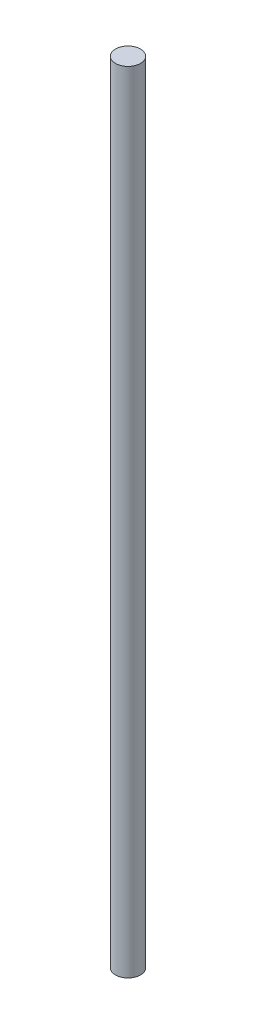
from build123d import *

# Parameters (mm, degrees)
SKETCH1_R           = 2.5
BOSS_EXTRUDE1_DEPTH = 158


with BuildPart() as part:
    # Sketch1 → Boss-Extrude1 (new body)
    with BuildSketch(Plane(origin=(0, 0, 0), x_dir=(1, 0, 0), z_dir=(0, 1, 0))):
        with Locations(Location((0, 0, 0), (0, 0, 270))):
            Circle(SKETCH1_R)
    extrude(amount=BOSS_EXTRUDE1_DEPTH)


solid = part.part
